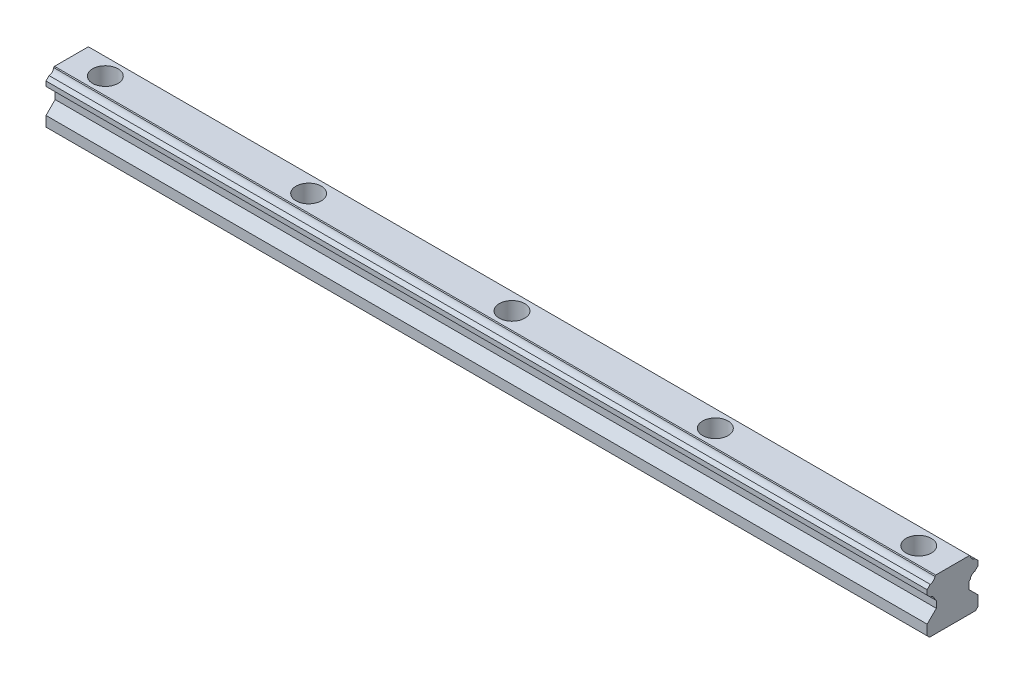
from build123d import *

# Parameters (mm, degrees)
EXTRUDE_1_DEPTH                  = 130
HOLE_WIZARD_M4_78051_D           = 4.5
HOLE_WIZARD_M4_78051_CBORE_D     = 7.5
HOLE_WIZARD_M4_78051_CBORE_DEPTH = 5.3
PATTERN_LINEAR_1_COUNT           = 3
PATTERN_LINEAR_1_PITCH           = 60
PATTERN_LINEAR_2_COUNT           = 3
PATTERN_LINEAR_2_PITCH           = 60


with BuildPart() as part:
    # Эскиз1 → Бобышка-Вытянуть1 (new, symmetric)
    with BuildSketch(Plane(origin=(0, 0, 0), x_dir=(0, 0, -1), z_dir=(1, 0, 0))):
        with BuildLine():
            Line((-7.5, 0.707106781), (-6.792893219, 0))
            Line((-6.792893219, 0), (6.792893219, 0))
            Line((6.792893219, 0), (7.5, 0.707106781))
            Line((7.5, 0.707106781), (7.5, 3.7))
            Line((7.5, 3.7), (4.8, 6.4))
            Line((4.8, 6.4), (4.8, 8.4))
            Line((4.8, 8.4), (5.21443454, 8.81443454))
            ThreePointArc((5.21443454, 8.81443454), (5.66862915, 9.73137085), (6.58556546, 10.18556546))
            Line((6.58556546, 10.18556546), (7.5, 11.1))
            Line((7.5, 11.1), (7.5, 12.5))
            Line((7.5, 12.5), (6.58556546, 13.41443454))
            ThreePointArc((6.58556546, 13.41443454), (5.66862915, 13.86862915), (5.21443454, 14.78556546))
            Line((5.21443454, 14.78556546), (5, 15))
            Line((5, 15), (-5, 15))
            Line((-5, 15), (-5.21443454, 14.78556546))
            ThreePointArc((-5.21443454, 14.78556546), (-5.66862915, 13.86862915), (-6.58556546, 13.41443454))
            Line((-6.58556546, 13.41443454), (-7.5, 12.5))
            Line((-7.5, 12.5), (-7.5, 11.1))
            Line((-7.5, 11.1), (-6.58556546, 10.18556546))
            ThreePointArc((-6.58556546, 10.18556546), (-5.66862915, 9.73137085), (-5.21443454, 8.81443454))
            Line((-5.21443454, 8.81443454), (-4.8, 8.4))
            Line((-4.8, 8.4), (-4.8, 6.4))
            Line((-4.8, 6.4), (-7.5, 3.7))
            Line((-7.5, 3.7), (-7.5, 0.707106781))
        make_face()
    extrude(amount=EXTRUDE_1_DEPTH, both=True)

    # Цековка M4 для болта с шестигранной головкой класса А ГОСТ 78051 (through all)
    with Locations(Plane(origin=(0, 15, 0), x_dir=(1, 0, 0), z_dir=(0, 1, 0))):
        with Locations((0, 0)):
            hole_wizard_m4_78051 = CounterBoreHole(HOLE_WIZARD_M4_78051_D / 2, HOLE_WIZARD_M4_78051_CBORE_D / 2, HOLE_WIZARD_M4_78051_CBORE_DEPTH)

    # Линейный массив1: Цековка M4 для болта с шестигранной головкой класса А ГОСТ 78051 ×3
    with Locations(*[(i * PATTERN_LINEAR_1_PITCH, 0, 0) for i in range(1, PATTERN_LINEAR_1_COUNT)]):
        add(hole_wizard_m4_78051, mode=Mode.SUBTRACT)

    # Линейный массив2: Цековка M4 для болта с шестигранной головкой класса А ГОСТ 78051 ×3
    with Locations(*[(-i * PATTERN_LINEAR_2_PITCH, 0, 0) for i in range(1, PATTERN_LINEAR_2_COUNT)]):
        add(hole_wizard_m4_78051, mode=Mode.SUBTRACT)


solid = part.part
